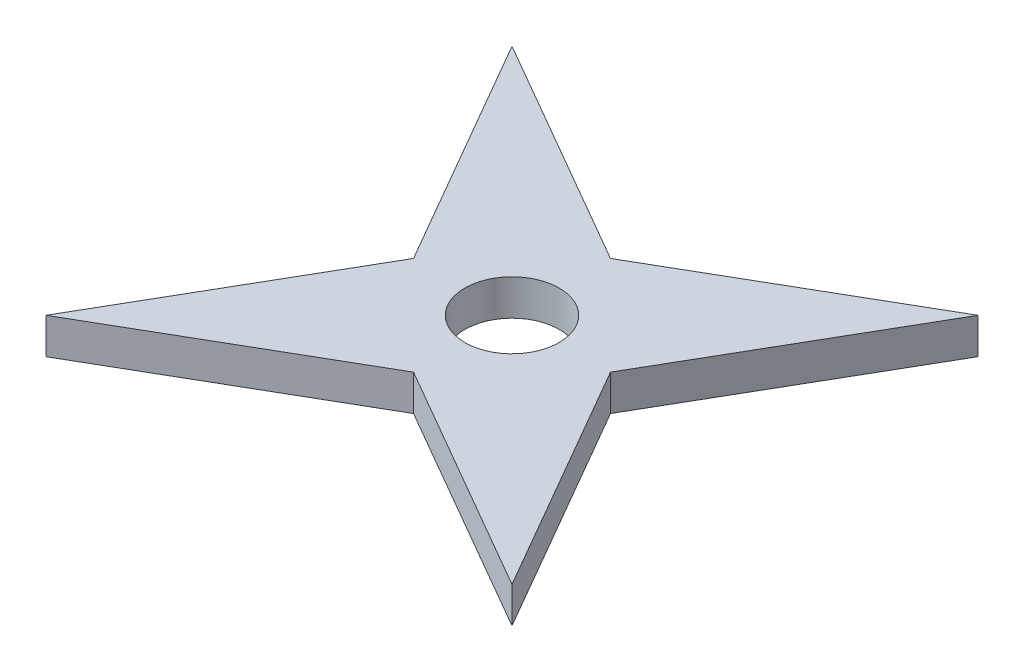
from build123d import *

# Parameters (mm, degrees)
SKETCH1_R           = 13.155
BOSS_EXTRUDE1_DEPTH = 10


with BuildPart() as part:
    # Sketch1 → Boss-Extrude1 (new body)
    with BuildSketch(Plane(origin=(0, 0, 0), x_dir=(1, 0, 0), z_dir=(0, 1, 0))):
        Polygon((0, 0), (37.5, 64.951905284), (0, 129.903810568), (64.951905284, 92.403810568), (129.903810568, 129.903810568), (92.403810568, 64.951905284), (129.903810568, 0), (64.951905284, 37.5), align=None)
        with Locations(Location((64.951905284, 64.951905284, 0), (0, 0, 270))):
            Circle(SKETCH1_R, mode=Mode.SUBTRACT)
    extrude(amount=BOSS_EXTRUDE1_DEPTH)


solid = part.part
